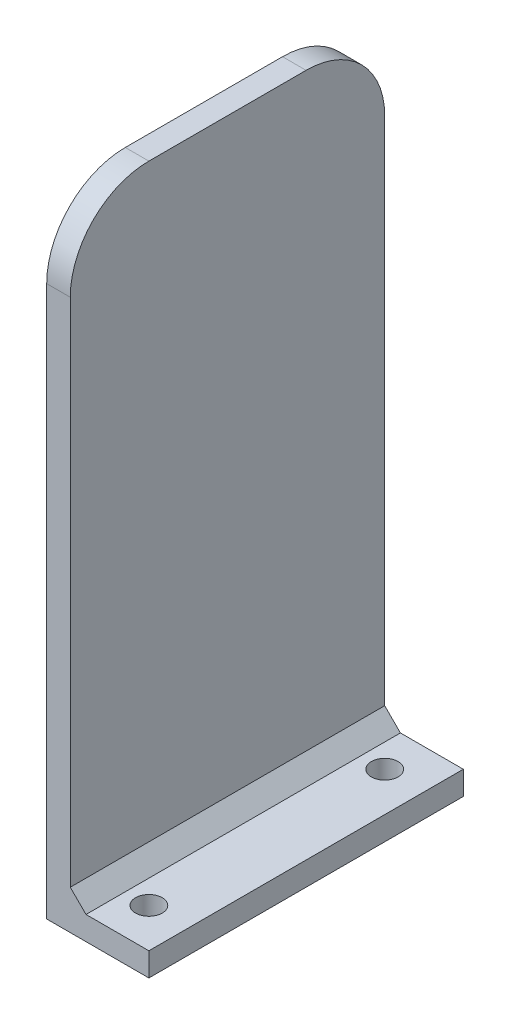
from build123d import *

# Parameters (mm, degrees)
BOSS_EXTRUDE1_DEPTH = 20
SKETCH2_R           = 1.7
CUT_EXTRUDE1_DEPTH  = 40
CHAMFER1_SIZE       = 2
FILLET1_R           = 10


with BuildPart() as part:
    # Sketch1 → Boss-Extrude1 (new, symmetric)
    with BuildSketch(Plane.XY):
        Polygon((0, 0), (13, 0), (13, 3), (3, 3), (3, 80), (0, 80), align=None)
    extrude(amount=BOSS_EXTRUDE1_DEPTH, both=True)

    # Sketch2 → Cut-Extrude1 (cut)
    with BuildSketch(Plane(origin=(0, 3, 0), x_dir=(1, 0, 0), z_dir=(0, 1, 0))):
        with Locations((8, 15)):
            Circle(SKETCH2_R)
        with Locations((8, -15)):
            Circle(SKETCH2_R)
    extrude(amount=-CUT_EXTRUDE1_DEPTH, mode=Mode.SUBTRACT)

    # Chamfer1
    chamfer1_edges = [part.edges().sort_by_distance(p)[0] for p in [
        (3, 3, 0),
    ]]
    chamfer(chamfer1_edges, length=CHAMFER1_SIZE)

    # Fillet1
    fillet1_edges = [part.edges().sort_by_distance(p)[0] for p in [
        (1.5, 80, 20),
        (1.5, 80, -20),
    ]]
    fillet(fillet1_edges, radius=FILLET1_R)


solid = part.part
